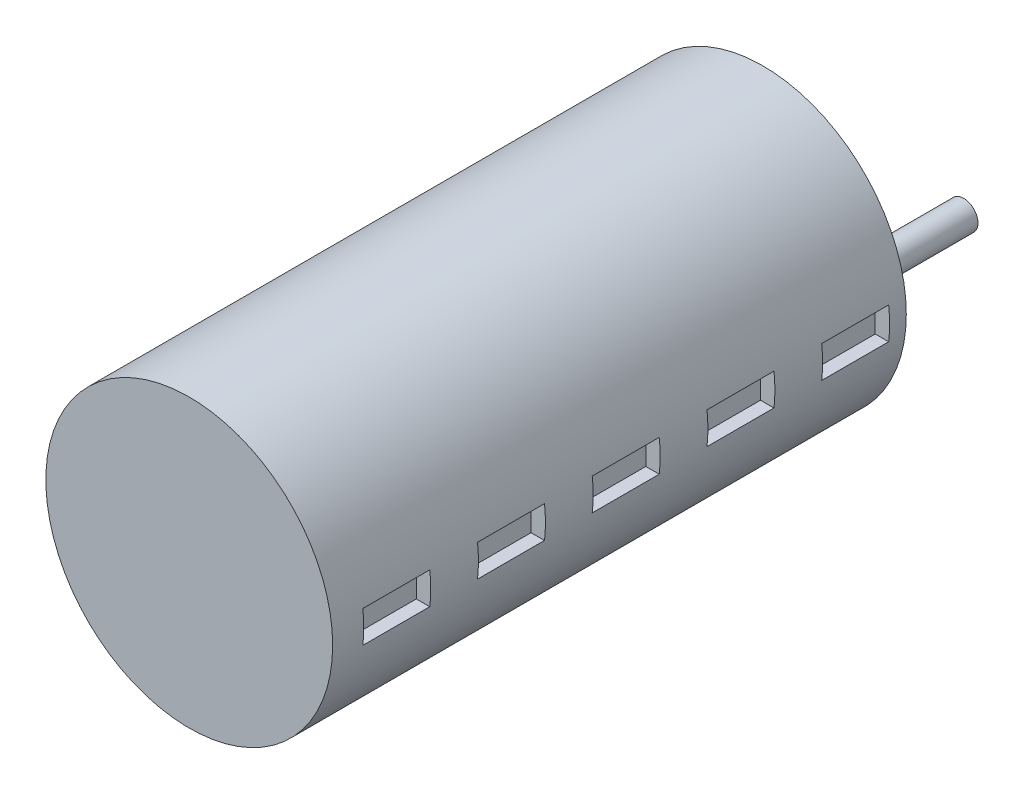
from build123d import *

# Parameters (mm, degrees)
SKETCH_1_R          = 2.5
EXTRUDE_1_DEPTH     = 10
SKETCH_2_R          = 0.25
EXTRUDE_2_DEPTH     = 2
SKETCH_3_W          = 1.167779505
SKETCH_3_H          = 0.556477286
CUT_EXTRUDE_1_DEPTH = 0.25


with BuildPart() as part:
    # 草图1 → 凸台-拉伸1 (new body)
    with BuildSketch(Plane.XY):
        Circle(SKETCH_1_R)
    extrude(amount=EXTRUDE_1_DEPTH)

    # 草图2 → 凸台-拉伸2 (add)
    with BuildSketch(Plane(origin=(0, 0, 0), x_dir=(-1, 0, 0), z_dir=(0, 0, -1))):
        with Locations(Location((-1.5, 0, 0), (0, 0, 180))):
            Circle(SKETCH_2_R)
        with Locations(Location((1.5, 0, 0), (0, 0, 180))):
            Circle(SKETCH_2_R)
    extrude(amount=EXTRUDE_2_DEPTH)

    # 草图3 → 切除-拉伸1 (cut)
    with BuildSketch(Plane(origin=(2.5, 0, 0), x_dir=(0, 0, -1), z_dir=(1, 0, 0))):
        with Locations((-8.875568116, 0)):
            Rectangle(SKETCH_3_W, SKETCH_3_H)
        with Locations((-6.875568116, 0)):
            Rectangle(SKETCH_3_W, SKETCH_3_H)
        with Locations((-4.875568116, 0)):
            Rectangle(SKETCH_3_W, SKETCH_3_H)
        with Locations((-2.875568116, 0)):
            Rectangle(SKETCH_3_W, SKETCH_3_H)
        with Locations((-0.875568116, 0)):
            Rectangle(SKETCH_3_W, SKETCH_3_H)
    extrude(amount=-CUT_EXTRUDE_1_DEPTH, mode=Mode.SUBTRACT)


solid = part.part
